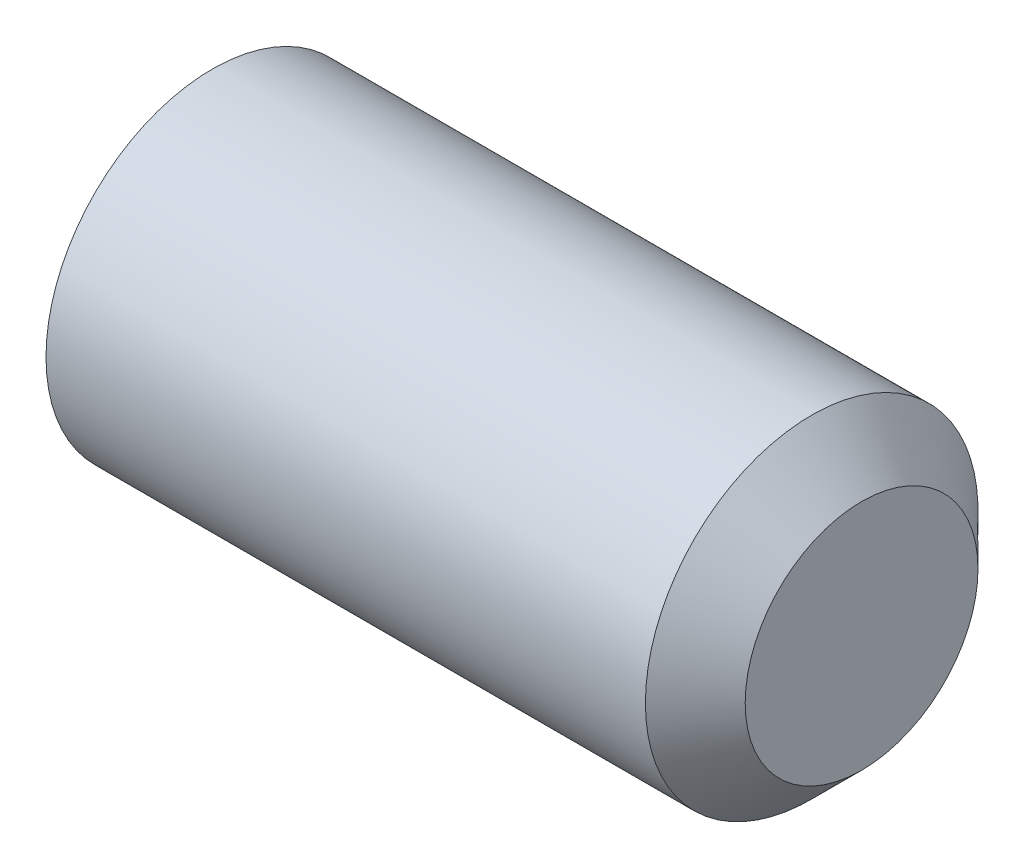
from build123d import *

# Parameters (mm, degrees)
HEX_2_DEPTH = 5


with BuildPart() as part:
    # BodySke → BaseBody (revolve)
    with BuildSketch(Plane.XY, mode=Mode.PRIVATE) as basebody_sk:
        Polygon((0, 0), (0, 4.172), (0.478046023, 5), (18.5, 5), (20, 3.5), (20, 0), align=None)
    revolve(basebody_sk.sketch.rotate(Axis((-12.7, 0, 0), (1, 0, 0)), 90), axis=Axis((-12.7, 0, 0), (1, 0, 0)))

    # Sketch2 → Hex 2 (cut)
    with BuildSketch(Plane.ZY):
        Polygon((1.443375673, 2.5), (-1.443375673, 2.5), (-2.886751346, 0), (-1.443375673, -2.5), (1.443375673, -2.5), (2.886751346, 0), align=None)
    extrude(amount=-HEX_2_DEPTH, mode=Mode.SUBTRACT)


solid = part.part
